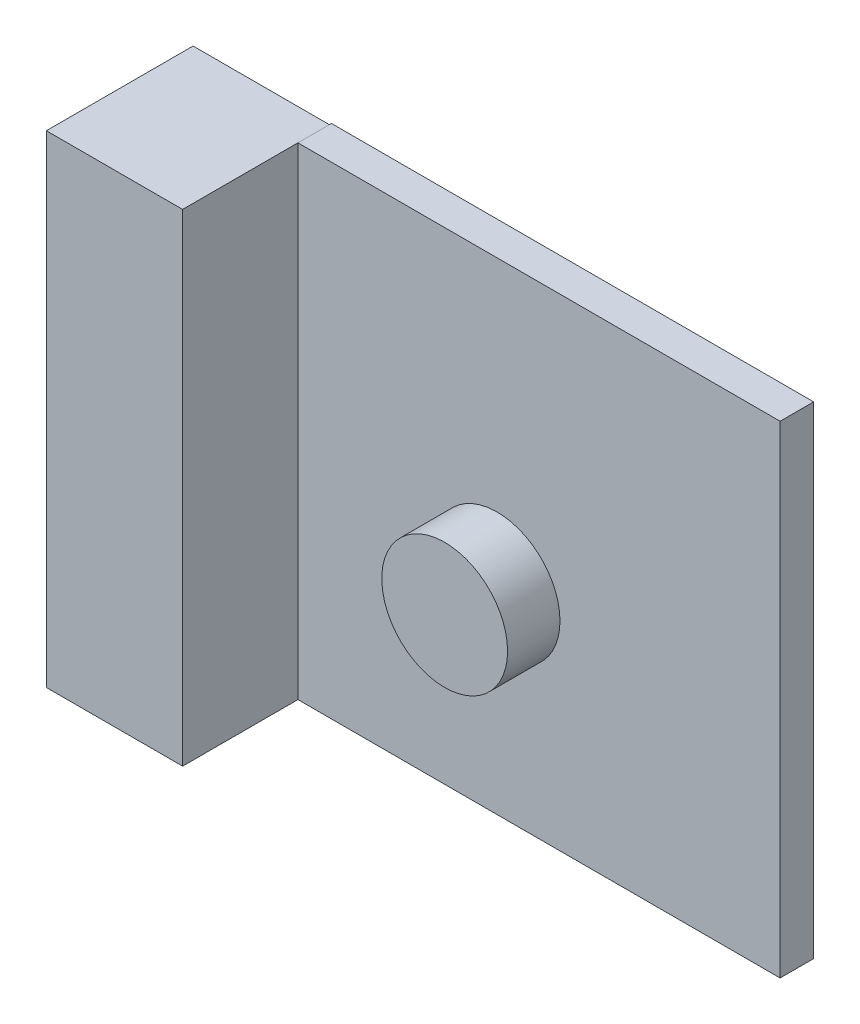
from build123d import *

# Parameters (mm, degrees)
MAGNET_START         = -35.5
SKETCH1_R            = 3
MAGNET_DEPTH         = 2.5
AS5600_BOARD_START   = 46.5
SKETCH2_W            = 1.6
SKETCH2_H            = 23
AS5600_BOARD_DEPTH   = 23
SENSOR_BRACKET_START = 40
SKETCH3_W            = 7
SKETCH3_H            = 23
SENSOR_BRACKET_DEPTH = 6.5


with BuildPart() as part:
    # Sketch1 → magnet (new body)
    with BuildSketch(Plane.XY.offset(MAGNET_START)):
        with Locations((58, 130)):
            Circle(SKETCH1_R)
    extrude(amount=MAGNET_DEPTH)


with BuildPart() as body_2:
    # Sketch2 → as5600_board (new body)
    with BuildSketch(Plane(origin=(0, 0, 0), x_dir=(0, 0, -1), z_dir=(1, 0, 0)).offset(AS5600_BOARD_START)):
        with Locations((38.3, 130)):
            Rectangle(SKETCH2_W, SKETCH2_H)
    extrude(amount=AS5600_BOARD_DEPTH)


with BuildPart() as body_3:
    # Sketch3 → sensor_bracket (new body)
    with BuildSketch(Plane(origin=(0, 0, 0), x_dir=(0, 0, -1), z_dir=(1, 0, 0)).offset(SENSOR_BRACKET_START)):
        with Locations((35.5, 130)):
            Rectangle(SKETCH3_W, SKETCH3_H)
    extrude(amount=SENSOR_BRACKET_DEPTH)


solid = Compound([part.part, body_2.part, body_3.part])
